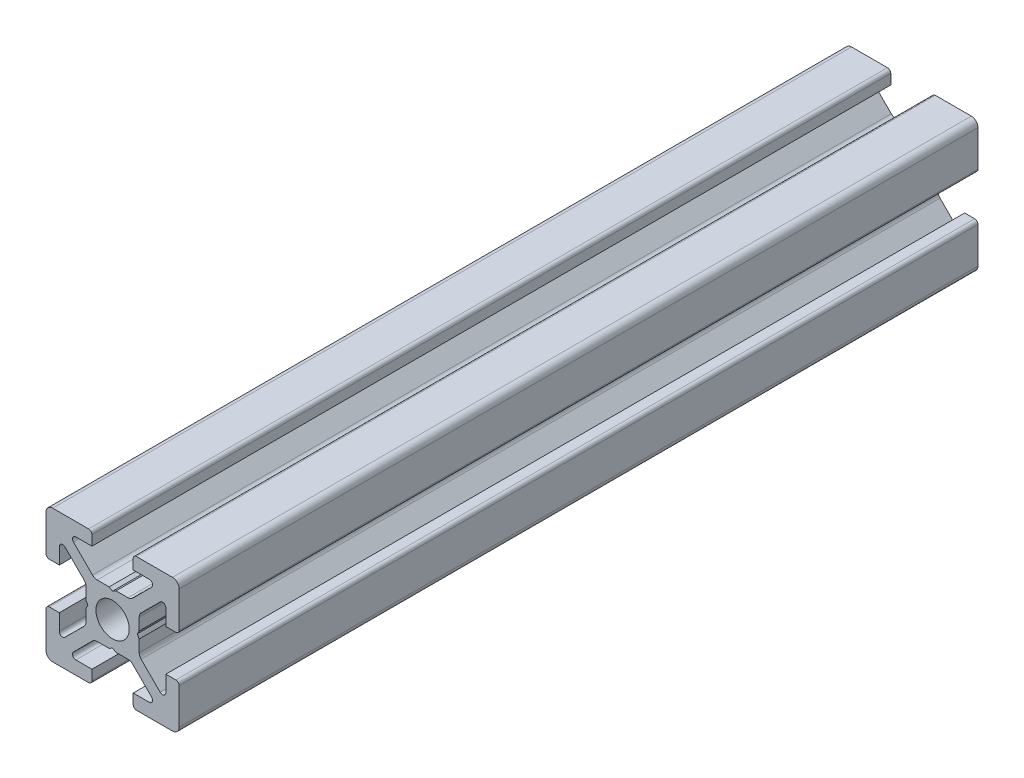
from build123d import *

# Parameters (mm, degrees)
SKETCH_1_R      = 2.5
EXTRUDE_1_DEPTH = 120


with BuildPart() as part:
    # 草图1 → 凸台-拉伸1 (new body)
    with BuildSketch(Plane.XY):
        with BuildLine():
            Line((16.486773435, 27.123343944), (19.340326826, 24.269790554))
            ThreePointArc((19.340326826, 24.269790554), (19.885221932, 24.161404178), (20.193880216, 24.623343944))
            Line((20.193880216, 24.623343944), (20.193880216, 27.043444957))
            Line((20.193880216, 27.043444957), (21.693880216, 27.043444957))
            ThreePointArc((21.693880216, 27.043444957), (22.047433607, 26.896998348), (22.193880216, 26.543444957))
            Line((22.193880216, 26.543444957), (22.193880216, 21.143444957))
            ThreePointArc((22.193880216, 21.143444957), (21.900986997, 20.436338176), (21.193880216, 20.143444957))
            Line((21.193880216, 20.143444957), (15.793880216, 20.143444957))
            ThreePointArc((15.793880216, 20.143444957), (15.440326826, 20.289891566), (15.293880216, 20.643444957))
            Line((15.293880216, 20.643444957), (15.293880216, 22.143444957))
            Line((15.293880216, 22.143444957), (17.713981229, 22.143444957))
            ThreePointArc((17.713981229, 22.143444957), (18.175920995, 22.452103241), (18.06753462, 22.996998348))
            Line((18.06753462, 22.996998348), (15.213981229, 25.850551738))
            ThreePointArc((15.213981229, 25.850551738), (14.88955788, 26.06732449), (14.506874448, 26.143444957))
            Line((14.506874448, 26.143444957), (12.713495459, 26.143444957))
            Line((12.713495459, 26.143444957), (12.193880216, 26.443444957))
            Line((12.193880216, 26.443444957), (11.674264974, 26.143444957))
            Line((11.674264974, 26.143444957), (9.880885985, 26.143444957))
            ThreePointArc((9.880885985, 26.143444957), (9.498202552, 26.06732449), (9.173779204, 25.850551738))
            Line((9.173779204, 25.850551738), (6.320225813, 22.996998348))
            ThreePointArc((6.320225813, 22.996998348), (6.211839437, 22.452103241), (6.673779204, 22.143444957))
            Line((6.673779204, 22.143444957), (9.093880216, 22.143444957))
            Line((9.093880216, 22.143444957), (9.093880216, 20.643444957))
            ThreePointArc((9.093880216, 20.643444957), (8.947433607, 20.289891566), (8.593880216, 20.143444957))
            Line((8.593880216, 20.143444957), (3.193880216, 20.143444957))
            ThreePointArc((3.193880216, 20.143444957), (2.486773435, 20.436338176), (2.193880216, 21.143444957))
            Line((2.193880216, 21.143444957), (2.193880216, 26.543444957))
            ThreePointArc((2.193880216, 26.543444957), (2.340326826, 26.896998348), (2.693880216, 27.043444957))
            Line((2.693880216, 27.043444957), (4.193880216, 27.043444957))
            Line((4.193880216, 27.043444957), (4.193880216, 24.623343944))
            ThreePointArc((4.193880216, 24.623343944), (4.5025385, 24.161404178), (5.047433607, 24.269790554))
            Line((5.047433607, 24.269790554), (7.900986997, 27.123343944))
            ThreePointArc((7.900986997, 27.123343944), (8.117759749, 27.447767293), (8.193880216, 27.830450726))
            Line((8.193880216, 27.830450726), (8.193880216, 29.623829715))
            Line((8.193880216, 29.623829715), (8.493880216, 30.143444957))
            Line((8.493880216, 30.143444957), (8.193880216, 30.663060199))
            Line((8.193880216, 30.663060199), (8.193880216, 32.456439189))
            ThreePointArc((8.193880216, 32.456439189), (8.117759749, 32.839122621), (7.900986997, 33.16354597))
            Line((7.900986997, 33.16354597), (5.047433607, 36.01709936))
            ThreePointArc((5.047433607, 36.01709936), (4.5025385, 36.125485736), (4.193880216, 35.66354597))
            Line((4.193880216, 35.66354597), (4.193880216, 33.243444957))
            Line((4.193880216, 33.243444957), (2.693880216, 33.243444957))
            ThreePointArc((2.693880216, 33.243444957), (2.340326826, 33.389891566), (2.193880216, 33.743444957))
            Line((2.193880216, 33.743444957), (2.193880216, 39.143444957))
            ThreePointArc((2.193880216, 39.143444957), (2.486773435, 39.850551738), (3.193880216, 40.143444957))
            Line((3.193880216, 40.143444957), (8.593880216, 40.143444957))
            ThreePointArc((8.593880216, 40.143444957), (8.947433607, 39.996998348), (9.093880216, 39.643444957))
            Line((9.093880216, 39.643444957), (9.093880216, 38.143444957))
            Line((9.093880216, 38.143444957), (6.673779204, 38.143444957))
            ThreePointArc((6.673779204, 38.143444957), (6.211839437, 37.834786673), (6.320225813, 37.289891566))
            Line((6.320225813, 37.289891566), (9.173779204, 34.436338176))
            ThreePointArc((9.173779204, 34.436338176), (9.498202552, 34.219565425), (9.880885985, 34.143444957))
            Line((9.880885985, 34.143444957), (11.674264974, 34.143444957))
            Line((11.674264974, 34.143444957), (12.193880216, 33.843444957))
            Line((12.193880216, 33.843444957), (12.713495459, 34.143444957))
            Line((12.713495459, 34.143444957), (14.506874448, 34.143444957))
            ThreePointArc((14.506874448, 34.143444957), (14.88955788, 34.219565425), (15.213981229, 34.436338176))
            Line((15.213981229, 34.436338176), (18.06753462, 37.289891566))
            ThreePointArc((18.06753462, 37.289891566), (18.175920995, 37.834786673), (17.713981229, 38.143444957))
            Line((17.713981229, 38.143444957), (15.293880216, 38.143444957))
            Line((15.293880216, 38.143444957), (15.293880216, 39.643444957))
            ThreePointArc((15.293880216, 39.643444957), (15.440326826, 39.996998348), (15.793880216, 40.143444957))
            Line((15.793880216, 40.143444957), (21.193880216, 40.143444957))
            ThreePointArc((21.193880216, 40.143444957), (21.900986997, 39.850551738), (22.193880216, 39.143444957))
            Line((22.193880216, 39.143444957), (22.193880216, 33.743444957))
            ThreePointArc((22.193880216, 33.743444957), (22.047433607, 33.389891566), (21.693880216, 33.243444957))
            Line((21.693880216, 33.243444957), (20.193880216, 33.243444957))
            Line((20.193880216, 33.243444957), (20.193880216, 35.66354597))
            ThreePointArc((20.193880216, 35.66354597), (19.885221932, 36.125485736), (19.340326826, 36.01709936))
            Line((19.340326826, 36.01709936), (16.486773435, 33.16354597))
            ThreePointArc((16.486773435, 33.16354597), (16.270000684, 32.839122621), (16.193880216, 32.456439189))
            Line((16.193880216, 32.456439189), (16.193880216, 30.663060199))
            Line((16.193880216, 30.663060199), (15.893880216, 30.143444957))
            Line((15.893880216, 30.143444957), (16.193880216, 29.623829715))
            Line((16.193880216, 29.623829715), (16.193880216, 27.830450726))
            ThreePointArc((16.193880216, 27.830450726), (16.270000684, 27.447767293), (16.486773435, 27.123343944))
        make_face()
        with Locations((12.193880216, 30.143444957)):
            Circle(SKETCH_1_R, mode=Mode.SUBTRACT)
    extrude(amount=EXTRUDE_1_DEPTH)


solid = part.part
